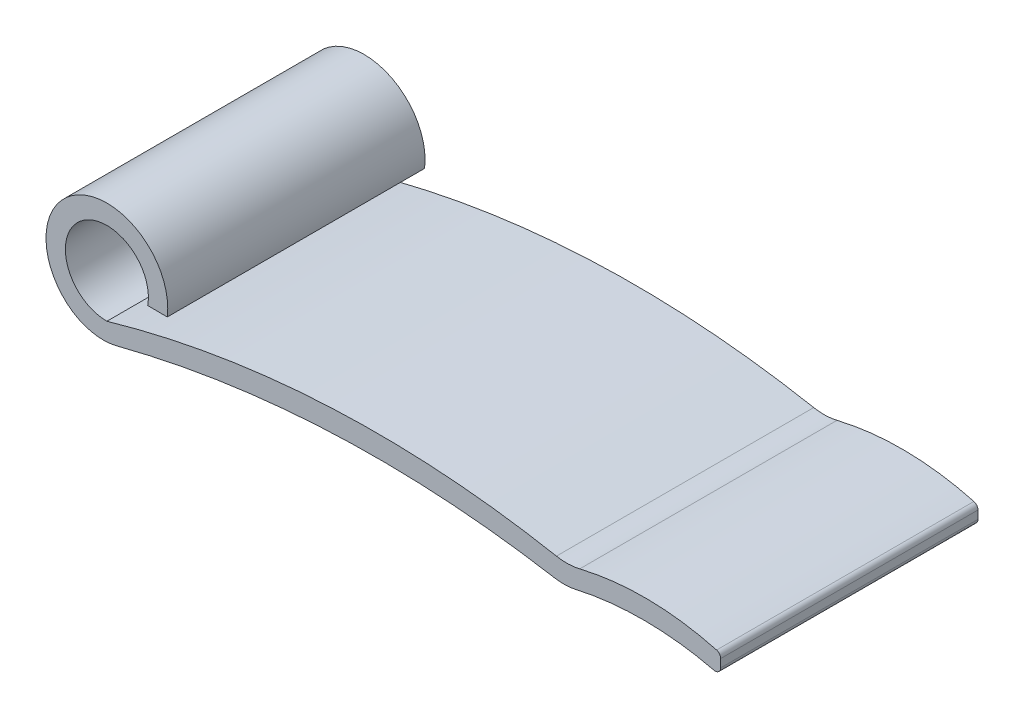
from build123d import *

# Parameters (mm, degrees)
BOSS_EXTRUDE1_DEPTH = 11.811
FILLET1_R           = 2.54
FILLET2_R           = 2.54
FILLET3_R           = 2.54
FILLET4_R           = 0.254


with BuildPart() as part:
    # Sketch1 → Boss-Extrude1 (new body)
    with BuildSketch(Plane.XY):
        with BuildLine():
            Line((28.176033565, -1.032201382), (28.176033565, -1.921201382))
            ThreePointArc((28.176033565, -1.921201382), (24.613856271, -1.460610767), (21.051678976, -1.921201382))
            ThreePointArc((21.051678976, -1.921201382), (10.446405641, -1.176341171), (-0.061202039, -2.794))
            ThreePointArc((-0.061202039, -2.794), (-1.825200311, 2.116323585), (2.772672487, -0.349955666))
            Line((2.772672487, -0.349955666), (1.874071212, -0.34188023))
            ThreePointArc((1.874071212, -0.34188023), (-1.220193255, 1.462926321), (0, -1.905))
            ThreePointArc((0, -1.905), (10.542698007, -0.186192099), (21.191033565, -1.032201382))
            ThreePointArc((21.191033565, -1.032201382), (24.683533565, -0.542543055), (28.176033565, -1.032201382))
        make_face()
    extrude(amount=BOSS_EXTRUDE1_DEPTH)

    # Fillet1
    fillet1_edges = [part.edges().sort_by_distance(p)[0] for p in [
        (-0.061202039, -2.794, 5.9055),
    ]]
    fillet(fillet1_edges, radius=FILLET1_R)

    # Fillet2
    fillet2_edges = [part.edges().sort_by_distance(p)[0] for p in [
        (21.051678976, -1.921201382, 5.9055),
    ]]
    fillet(fillet2_edges, radius=FILLET2_R)

    # Fillet3
    fillet3_edges = [part.edges().sort_by_distance(p)[0] for p in [
        (21.191033565, -1.032201382, 5.9055),
    ]]
    fillet(fillet3_edges, radius=FILLET3_R)

    # Fillet4
    fillet4_edges = [part.edges().sort_by_distance(p)[0] for p in [
        (28.176033565, -1.032201382, 5.9055),
        (28.176033565, -1.921201382, 5.9055),
    ]]
    fillet(fillet4_edges, radius=FILLET4_R)


solid = part.part
